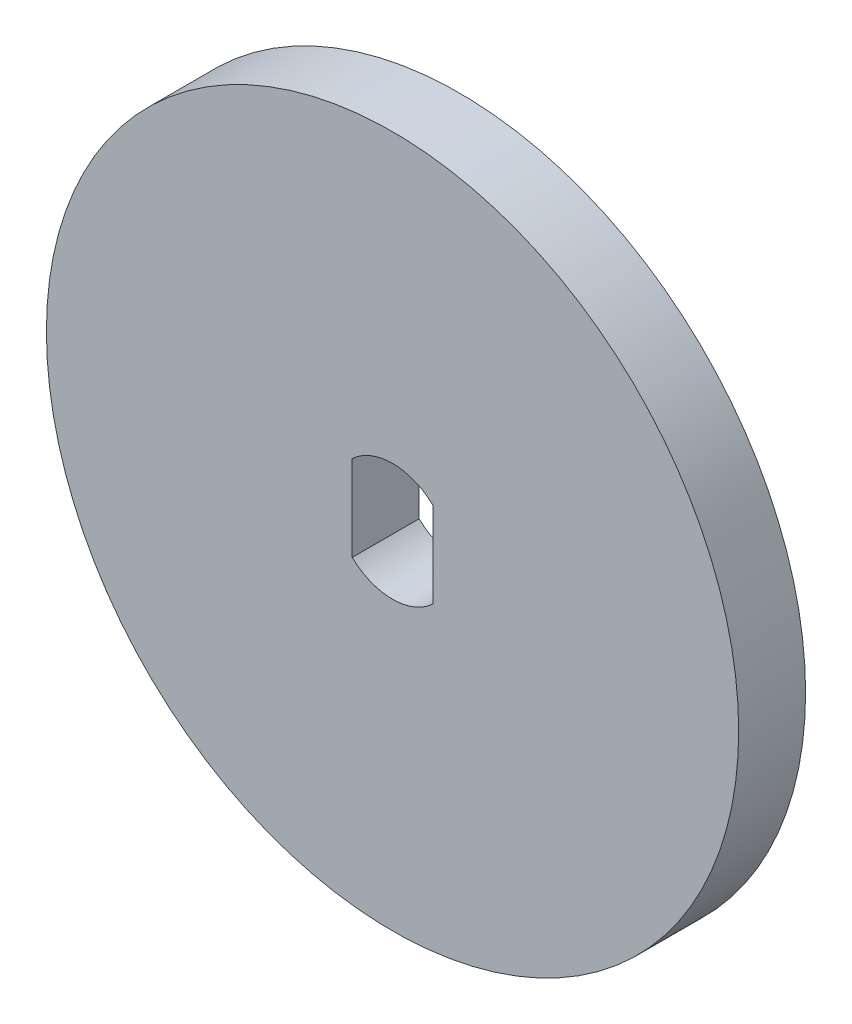
from build123d import *

# Parameters (mm, degrees)
SKETCH1_R           = 15
BOSS_EXTRUDE1_DEPTH = 1.45


with BuildPart() as part:
    # Sketch1 → Boss-Extrude1 (new, symmetric)
    with BuildSketch(Plane.XY):
        Circle(SKETCH1_R)
        with BuildLine():
            Line((1.75, -1.854723699), (1.75, 1.854723699))
            ThreePointArc((1.75, 1.854723699), (0, 2.55), (-1.75, 1.854723699))
            Line((-1.75, 1.854723699), (-1.75, -1.854723699))
            ThreePointArc((-1.75, -1.854723699), (0, -2.55), (1.75, -1.854723699))
        make_face(mode=Mode.SUBTRACT)
    extrude(amount=BOSS_EXTRUDE1_DEPTH, both=True)


solid = part.part
